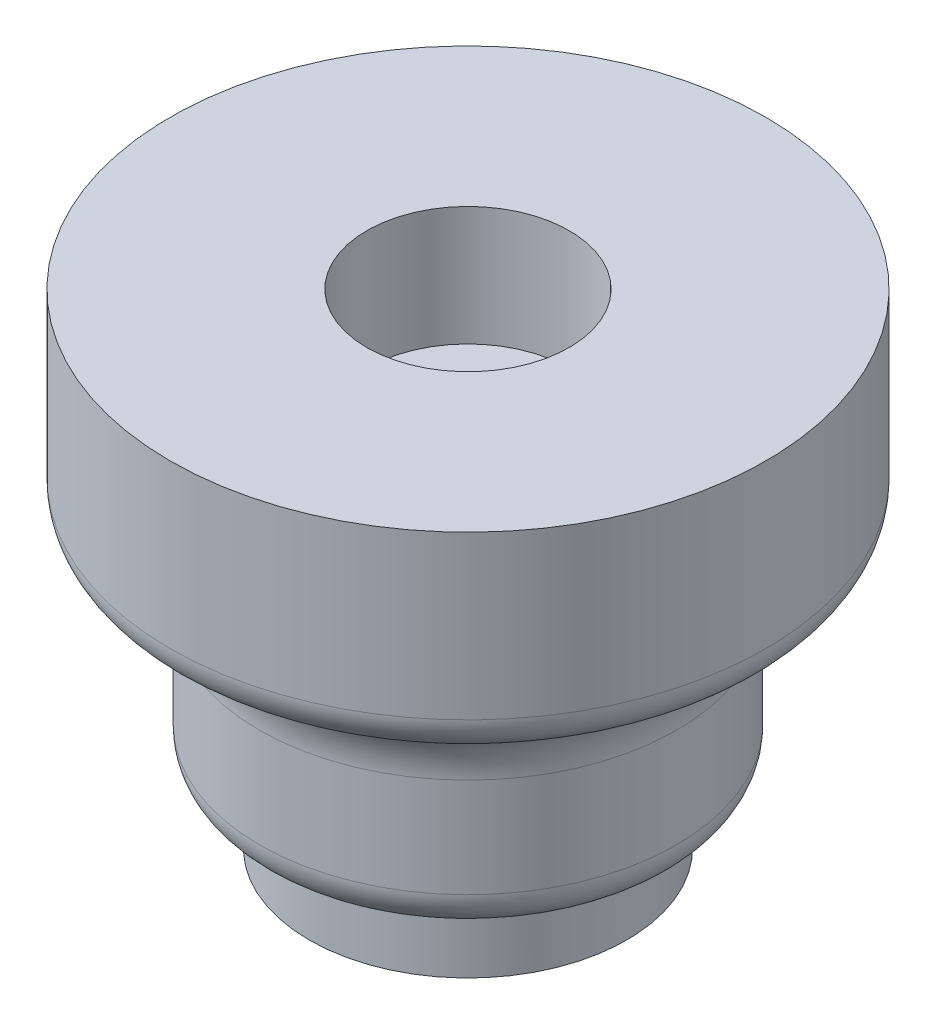
from build123d import *

# Parameters (mm, degrees)
SKETCH1_R           = 5.25
BOSS_EXTRUDE1_DEPTH = 5.5
SKETCH2_R           = 4
BOSS_EXTRUDE2_DEPTH = 1.7
FILLET1_R           = 0.15
SKETCH3_R           = 7.5
BOSS_EXTRUDE3_DEPTH = 5
SKETCH4_R           = 2.55
CUT_EXTRUDE1_DEPTH  = 3
CUT_EXTRUDE2_DEPTH  = 4.7
FILLET2_R           = 2
FILLET3_R           = 1
FILLET4_R           = 1


with BuildPart() as part:
    # Sketch1 → Boss-Extrude1 (new body)
    with BuildSketch(Plane(origin=(0, 0, 0), x_dir=(1, 0, 0), z_dir=(0, 1, 0))):
        with Locations(Location((0, 0, 0), (0, 0, 270))):
            Circle(SKETCH1_R)
    extrude(amount=BOSS_EXTRUDE1_DEPTH)

    # Sketch2 → Boss-Extrude2 (add)
    with BuildSketch(Plane.XZ):
        with Locations(Location((0, 0, 0), (0, 0, 270))):
            Circle(SKETCH2_R)
    extrude(amount=BOSS_EXTRUDE2_DEPTH)

    # Fillet1
    fillet1_edges = [part.edges().sort_by_distance(p)[0] for p in [
        (0, 0, 4),
    ]]
    fillet(fillet1_edges, radius=FILLET1_R)

    # Sketch3 → Boss-Extrude3 (add)
    with BuildSketch(Plane(origin=(0, 5.5, 0), x_dir=(1, 0, 0), z_dir=(0, 1, 0))):
        with Locations(Location((0, 0, 0), (0, 0, 270))):
            Circle(SKETCH3_R)
    extrude(amount=BOSS_EXTRUDE3_DEPTH)

    # Sketch4 → Cut-Extrude1 (cut)
    with BuildSketch(Plane(origin=(0, 10.5, 0), x_dir=(1, 0, 0), z_dir=(0, 1, 0))):
        with Locations(Location((0, 0, 0), (0, 0, 270))):
            Circle(SKETCH4_R)
    extrude(amount=-CUT_EXTRUDE1_DEPTH, mode=Mode.SUBTRACT)

    # Sketch5 → Cut-Extrude2 (cut)
    with BuildSketch(Plane.XZ.offset(1.7)):
        Polygon((2.713546265, 0), (1.356773133, 2.35), (-1.356773133, 2.35), (-2.713546265, 0), (-1.356773133, -2.35), (1.356773133, -2.35), align=None)
    extrude(amount=-CUT_EXTRUDE2_DEPTH, mode=Mode.SUBTRACT)

    # Fillet2
    fillet2_edges = [part.edges().sort_by_distance(p)[0] for p in [
        (0, 5.5, -5.25),
    ]]
    fillet(fillet2_edges, radius=FILLET2_R)

    # Fillet3
    fillet3_edges = [part.edges().sort_by_distance(p)[0] for p in [
        (0, 0, -5.25),
    ]]
    fillet(fillet3_edges, radius=FILLET3_R)

    # Fillet4
    fillet4_edges = [part.edges().sort_by_distance(p)[0] for p in [
        (0, 5.5, -7.5),
    ]]
    fillet(fillet4_edges, radius=FILLET4_R)


solid = part.part
